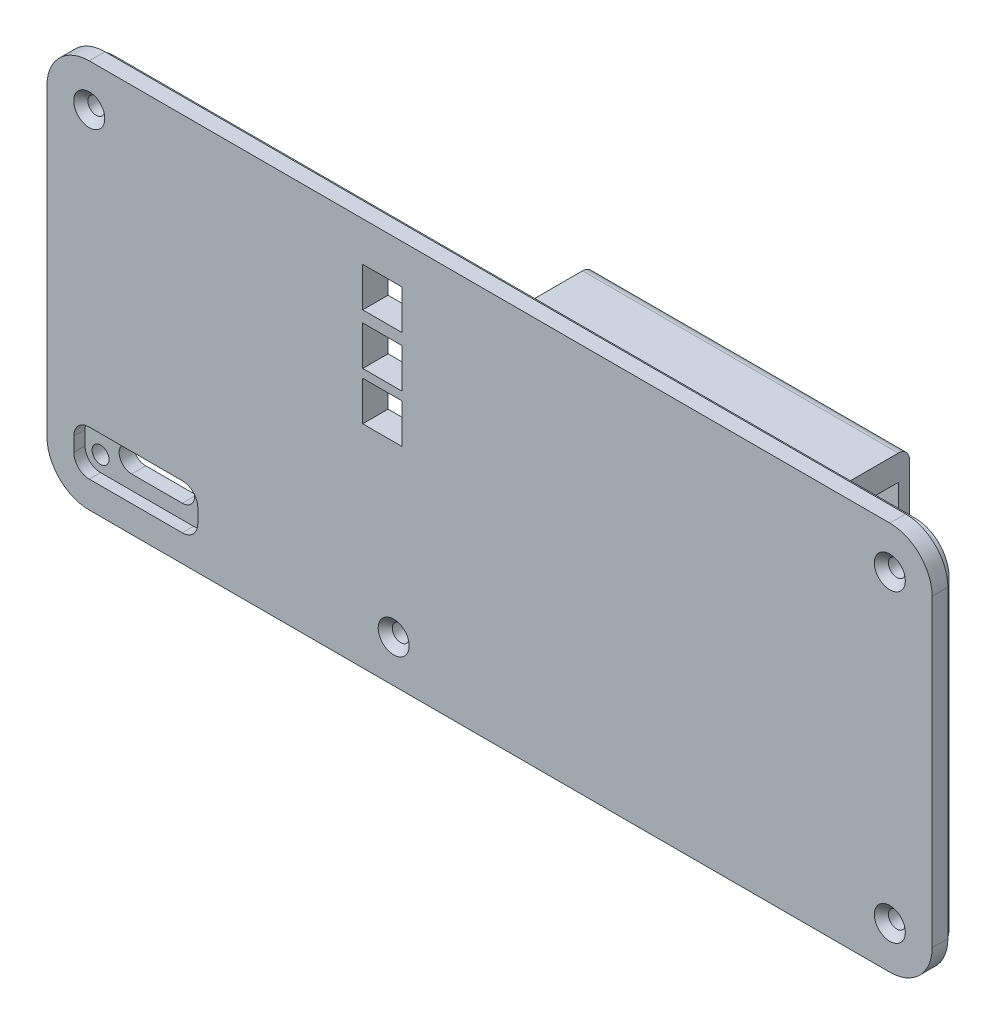
from build123d import *

# Parameters (mm, degrees)
EXTRUDE_1_DEPTH             = 2.8
EXTRUDE_2_DEPTH             = 4.5
SKETCH_2_R                  = 1.5
CUT_EXTRUDE_1_DEPTH         = 5
PATTERN_LINEAR_1_COUNT      = 2
PATTERN_LINEAR_1_PITCH      = 142
PATTERN_LINEAR_1_COUNT_DIR2 = 2
PATTERN_LINEAR_1_PITCH_DIR2 = 54
CUT_EXTRUDE_2_DEPTH         = 2
SKETCH_7_R                  = 1.5
CUT_EXTRUDE_3_DEPTH         = 3
SKETCH_8_W                  = 7
SKETCH_8_H                  = 7
CUT_EXTRUDE_4_DEPTH         = 5
EXTRUDE_3_DEPTH             = 56
FILLET_1_R                  = 2


with BuildPart() as part:
    # 草图1 → 凸台-拉伸1 (new body)
    with BuildSketch(Plane.XY):
        with BuildLine():
            Line((-71, -34.5), (71, -34.5))
            ThreePointArc((71, -34.5), (76.303300859, -32.303300859), (78.5, -27))
            Line((78.5, -27), (78.5, 27))
            ThreePointArc((78.5, 27), (76.303300859, 32.303300859), (71, 34.5))
            Line((71, 34.5), (-71, 34.5))
            ThreePointArc((-71, 34.5), (-76.303300859, 32.303300859), (-78.5, 27))
            Line((-78.5, 27), (-78.5, -27))
            ThreePointArc((-78.5, -27), (-76.303300859, -32.303300859), (-71, -34.5))
        make_face()
        with BuildLine():
            Line((-71, -33), (71, -33))
            ThreePointArc((71, -33), (75.242640687, -31.242640687), (77, -27))
            Line((77, -27), (77, 27))
            ThreePointArc((77, 27), (75.242640687, 31.242640687), (71, 33))
            Line((71, 33), (-71, 33))
            ThreePointArc((-71, 33), (-75.242640687, 31.242640687), (-77, 27))
            Line((-77, 27), (-77, -27))
            ThreePointArc((-77, -27), (-75.242640687, -31.242640687), (-71, -33))
        make_face(mode=Mode.SUBTRACT)
    extrude(amount=-EXTRUDE_1_DEPTH)

    # 草图1<2> → 凸台-拉伸2 (add)
    with BuildSketch(Plane.XY):
        with BuildLine():
            ThreePointArc((-77, -27), (-75.242640687, -31.242640687), (-71, -33))
            Line((-71, -33), (71, -33))
            ThreePointArc((71, -33), (75.242640687, -31.242640687), (77, -27))
            Line((77, -27), (77, 27))
            ThreePointArc((77, 27), (75.242640687, 31.242640687), (71, 33))
            Line((71, 33), (-71, 33))
            ThreePointArc((-71, 33), (-75.242640687, 31.242640687), (-77, 27))
            Line((-77, 27), (-77, -27))
        make_face()
    extrude(amount=-EXTRUDE_2_DEPTH)

    # 草图2 → 切除-拉伸1 (cut)
    with BuildSketch(Plane.XY):
        with Locations((-71, 27)):
            Circle(SKETCH_2_R)
        with Locations((-71, -27)):
            Circle(SKETCH_2_R)
        with Locations((71, 27)):
            Circle(SKETCH_2_R)
        with Locations((71, -27)):
            Circle(SKETCH_2_R)
        with Locations((-17, -27)):
            Circle(SKETCH_2_R)
    extrude(amount=-CUT_EXTRUDE_1_DEPTH, mode=Mode.SUBTRACT)

    # 草图4 → 切除-旋转1 (revolve, cut)
    with BuildSketch(Plane(origin=(-71, 0, 0), x_dir=(0, 0, -1), z_dir=(1, 0, 0))):
        Polygon((2.75, 27), (0, 27), (0, 29.75), align=None)
    cut_revolve_1 = revolve(axis=Axis((-71, 27, 0.2), (0, 0, -1)), mode=Mode.SUBTRACT)

    # 阵列(线性)1: Cut-Revolve 1 2 × 2
    with Locations(*[(i * PATTERN_LINEAR_1_PITCH, -j * PATTERN_LINEAR_1_PITCH_DIR2, 0) for i in range(PATTERN_LINEAR_1_COUNT) for j in range(PATTERN_LINEAR_1_COUNT_DIR2) if (i, j) != (0, 0)]):
        add(cut_revolve_1, mode=Mode.SUBTRACT)

    # 草图5 → 切除-旋转2 (revolve, cut)
    with BuildSketch(Plane(origin=(-17, 0, 0), x_dir=(0, 0, -1), z_dir=(1, 0, 0))):
        Polygon((2.75, -27), (0, -27), (0, -24.25), align=None)
    revolve(axis=Axis((-17, -27, 0.2), (0, 0, -1)), mode=Mode.SUBTRACT)

    # 草图6 → 切除-拉伸2 (cut)
    with BuildSketch(Plane.XY):
        with BuildLine():
            Line((-71, -21.75), (-54.5, -21.75))
            ThreePointArc((-54.5, -21.75), (-52.555456352, -22.555456352), (-51.75, -24.5))
            Line((-51.75, -24.5), (-51.75, -27))
            ThreePointArc((-51.75, -27), (-52.555456352, -28.944543648), (-54.5, -29.75))
            Line((-54.5, -29.75), (-71, -29.75))
            ThreePointArc((-71, -29.75), (-72.944543648, -28.944543648), (-73.75, -27))
            Line((-73.75, -27), (-73.75, -24.5))
            ThreePointArc((-73.75, -24.5), (-72.944543648, -22.555456352), (-71, -21.75))
        make_face()
    extrude(amount=-CUT_EXTRUDE_2_DEPTH, mode=Mode.SUBTRACT)

    # 草图7 → 切除-拉伸3 (cut)
    with BuildSketch(Plane.XY.offset(-2)):
        with Locations((-71, -27)):
            Circle(SKETCH_7_R)
        with BuildLine():
            Line((-65.5, -22.8), (-56.5, -22.8))
            ThreePointArc((-56.5, -22.8), (-54.3, -25), (-56.5, -27.2))
            Line((-56.5, -27.2), (-65.5, -27.2))
            ThreePointArc((-65.5, -27.2), (-67.7, -25), (-65.5, -22.8))
        make_face()
    extrude(amount=-CUT_EXTRUDE_3_DEPTH, mode=Mode.SUBTRACT)

    # 草图8 → 切除-拉伸4 (cut)
    with BuildSketch(Plane.XY):
        with Locations((-19, 24)):
            Rectangle(SKETCH_8_W, SKETCH_8_H)
        with Locations((-19, 15)):
            Rectangle(SKETCH_8_W, SKETCH_8_H)
        with Locations((-19, 6.5)):
            Rectangle(SKETCH_8_W, SKETCH_8_H)
    extrude(amount=-CUT_EXTRUDE_4_DEPTH, mode=Mode.SUBTRACT)

    # 草图9 → 凸台-拉伸3 (add)
    with BuildSketch(Plane(origin=(55, 0, 0), x_dir=(0, 0, -1), z_dir=(1, 0, 0))):
        Polygon((17.5, -24), (4.5, -24), (4.5, -28.5), (19.5, -28.5), (19.5, 28.5), (4.5, 28.5), (4.5, 24), (17.5, 24), align=None)
    extrude(amount=-EXTRUDE_3_DEPTH)

    # 圆角1
    fillet_1_edges = [part.edges().sort_by_distance(p)[0] for p in [
        (27, -28.5, -19.5),
        (27, 28.5, -19.5),
    ]]
    fillet(fillet_1_edges, radius=FILLET_1_R)


solid = part.part
